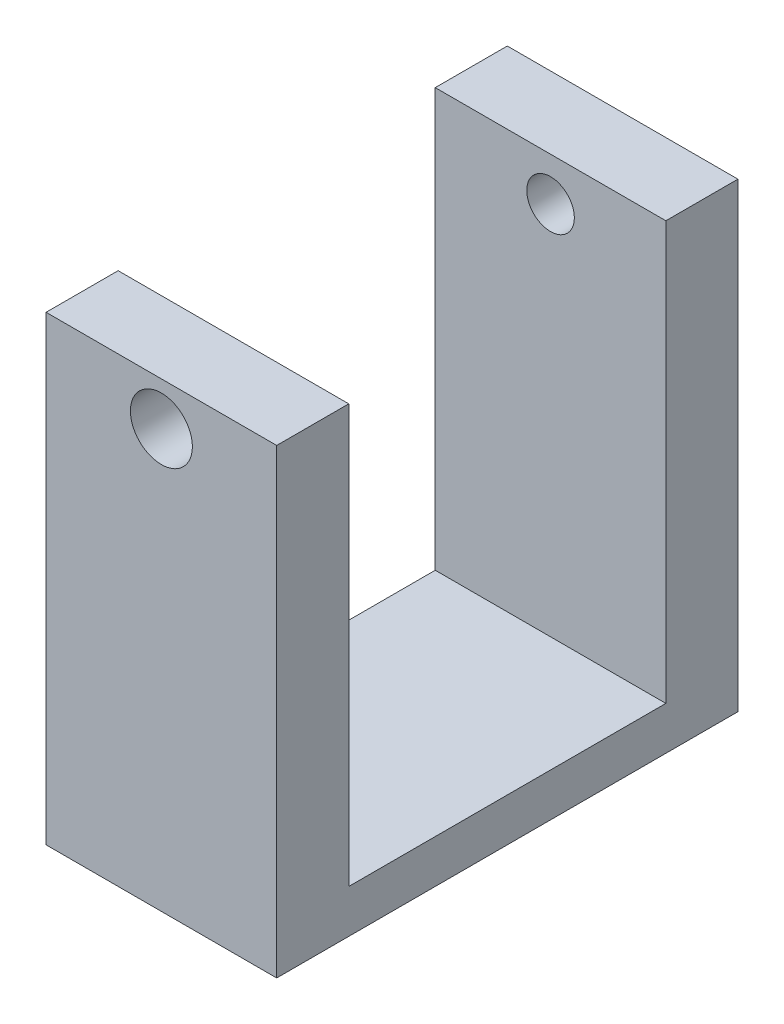
from build123d import *

# Parameters (mm, degrees)
EXTRUDE_1_DEPTH        = 8
HOLE_WIZARD_M4_1_D     = 4.3
HOLE_WIZARD_M4_1_DEPTH = 5
HOLE_WIZARD_M4_1_2_D   = 3.3
HOLE_WIZARD_M3_1_D     = 2.5
HOLE_WIZARD_M3_1_DEPTH = 8.5
HOLE_WIZARD_M3_1_TIP   = 0.751075774


with BuildPart() as part:
    # 草图1 → 凸台-拉伸1 (new, symmetric)
    with BuildSketch(Plane(origin=(0, 0, 0), x_dir=(0, 0, -1), z_dir=(1, 0, 0))):
        Polygon((-11, 32), (-11, 3), (11, 3), (11, 32), (16, 32), (16, 0), (-16, 0), (-16, 32), align=None)
    extrude(amount=EXTRUDE_1_DEPTH, both=True)

    # Hole Wizard M4 _1
    with Locations(Plane.XY.offset(16)):
        with Locations((0, 29)):
            Hole(HOLE_WIZARD_M4_1_D / 2, depth=HOLE_WIZARD_M4_1_DEPTH)

    # Hole Wizard M4 _1 2 (through all)
    with Locations(Plane(origin=(0, 0, -16), x_dir=(-1, 0, 0), z_dir=(0, 0, -1))):
        with Locations((0, 29)):
            Hole(HOLE_WIZARD_M4_1_2_D / 2)

    # M3 螺纹孔1
    with Locations(Plane(origin=(0, 0, 0), x_dir=(-1, 0, 0), z_dir=(0, -1, 0))):
        with Locations((0, 13.5), (0, -13.5)):
            Hole(HOLE_WIZARD_M3_1_D / 2, depth=HOLE_WIZARD_M3_1_DEPTH)
            with Locations((0, 0, -(HOLE_WIZARD_M3_1_DEPTH + HOLE_WIZARD_M3_1_TIP / 2))):  # 118° drill point
                Cone(0, HOLE_WIZARD_M3_1_D / 2, HOLE_WIZARD_M3_1_TIP, mode=Mode.SUBTRACT)


solid = part.part
